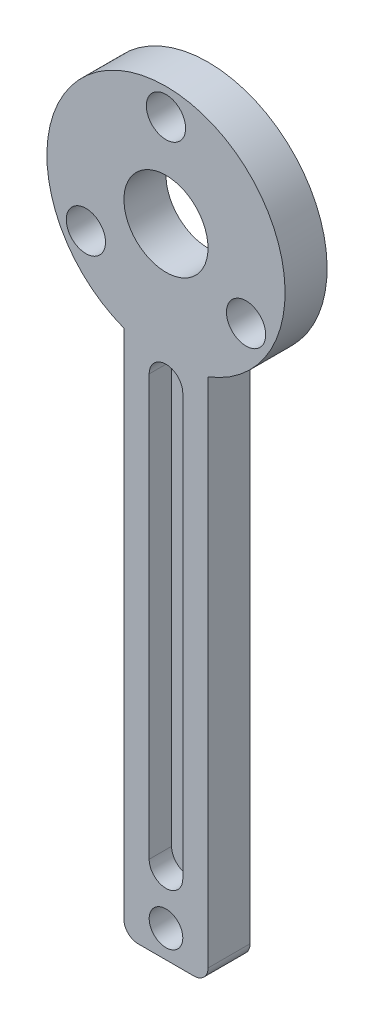
from build123d import *

# Parameters (mm, degrees)
SKETCH1_W           = 3
SKETCH1_H           = 1.5
BOSS_EXTRUDE1_DEPTH = 0.75
BOSS_EXTRUDE2_DEPTH = 0.75
SKETCH4_R           = 1.5
SKETCH4_R_2         = 0.7
CUT_EXTRUDE1_DEPTH  = 27.634094691
CUT_EXTRUDE2_DEPTH  = 0.8
FILLET1_R           = 0.5
SKETCH7_R           = 0.6
CUT_EXTRUDE4_DEPTH  = 4


with BuildPart() as part:
    # Sketch1 → Boss-Extrude1 (new, symmetric)
    with BuildSketch(Plane(origin=(0, 0, 0), x_dir=(1, 0, 0), z_dir=(0, 1, 0))):
        Rectangle(SKETCH1_W, SKETCH1_H)
    extrude(amount=BOSS_EXTRUDE1_DEPTH, both=True)

    # Sketch2 → Boss-Extrude2 (add, symmetric)
    with BuildSketch(Plane.XY):
        with BuildLine():
            Line((1.5, 0), (1.5, 18.02350657))
            ThreePointArc((1.5, 18.02350657), (0, 26.25), (-1.5, 18.02350657))
            Line((-1.5, 18.02350657), (-1.5, 0))
            Line((-1.5, 0), (1.5, 0))
        make_face()
    extrude(amount=BOSS_EXTRUDE2_DEPTH, both=True)

    # Sketch4 → Cut-Extrude1 (cut, through all)
    with BuildSketch(Plane.XY.offset(0.75)):
        with Locations((0, 22)):
            Circle(SKETCH4_R)
        with Locations((0, 25.3)):
            Circle(SKETCH4_R_2)
        with Locations((2.857883832, 20.35)):
            Circle(SKETCH4_R_2)
        with Locations((-2.857883832, 20.35)):
            Circle(SKETCH4_R_2)
    extrude(amount=-CUT_EXTRUDE1_DEPTH, mode=Mode.SUBTRACT)

    # Sketch5 → Cut-Extrude2 (cut)
    with BuildSketch(Plane.XY.offset(0.75)):
        with BuildLine():
            Line((0.6, 17.061134616), (0.6, 2.061134616))
            ThreePointArc((0.6, 2.061134616), (0, 1.461134616), (-0.6, 2.061134616))
            Line((-0.6, 2.061134616), (-0.6, 17.061134616))
            ThreePointArc((-0.6, 17.061134616), (0, 17.661134616), (0.6, 17.061134616))
        make_face()
    extrude(amount=-CUT_EXTRUDE2_DEPTH, mode=Mode.SUBTRACT)

    # Fillet1
    fillet1_edges = [part.edges().sort_by_distance(p)[0] for p in [
        (-1.5, -0.75, 0),
        (1.5, -0.75, 0),
    ]]
    fillet(fillet1_edges, radius=FILLET1_R)

    # Sketch7 → Cut-Extrude4 (cut, symmetric)
    with BuildSketch(Plane.XY):
        with Locations((0, 0.227167564)):
            Circle(SKETCH7_R)
    extrude(amount=CUT_EXTRUDE4_DEPTH, both=True, mode=Mode.SUBTRACT)


solid = part.part
